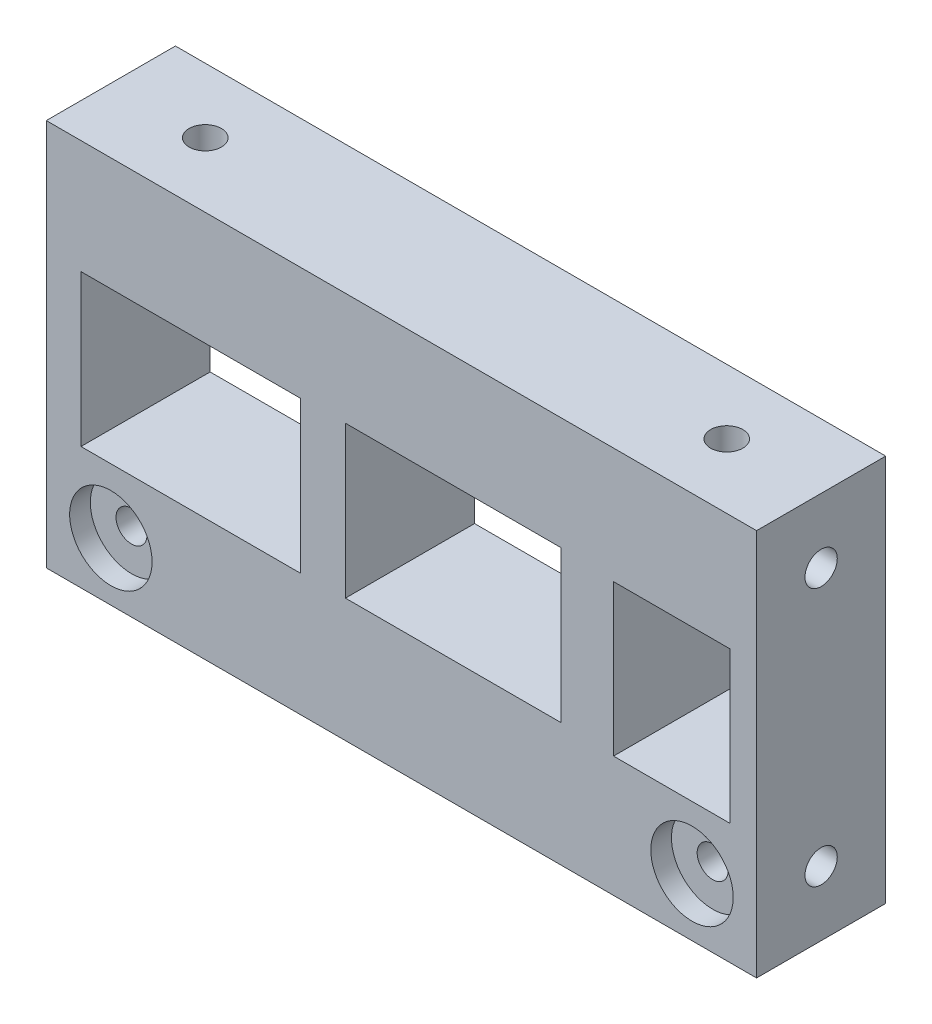
from build123d import *

# Parameters (mm, degrees)
SKETCH1_W                                        = 55
SKETCH1_H                                        = 30
BOSS_EXTRUDE1_DEPTH                              = 10
SKETCH3_W                                        = 16.992180867
SKETCH3_H                                        = 11.731003527
SKETCH3_W_2                                      = 16.707792902
SKETCH3_W_3                                      = 9.029317866
SKETCH3_H_2                                      = 11.700356954
CUT_EXTRUDE1_DEPTH                               = 33.882366095
CBORE_FOR_M2_HEX_HEAD_MACHINE_SCREW2_D           = 2.4
CBORE_FOR_M2_HEX_HEAD_MACHINE_SCREW2_CBORE_D     = 6.38
CBORE_FOR_M2_HEX_HEAD_MACHINE_SCREW2_CBORE_DEPTH = 1.6
M3X0_5_TAPPED_HOLE3_D                            = 2.5
M3X0_5_TAPPED_HOLE3_DEPTH                        = 3
M3X0_5_TAPPED_HOLE3_TIP                          = 0.751075774


with BuildPart() as part:
    # Sketch1 → Boss-Extrude1 (new body)
    with BuildSketch(Plane.XY):
        Rectangle(SKETCH1_W, SKETCH1_H)
    extrude(amount=BOSS_EXTRUDE1_DEPTH)

    # Sketch3 → Cut-Extrude1 (cut, through all)
    with BuildSketch(Plane.XY.offset(10)):
        with Locations((-16.316759452, 0.350583033)):
            Rectangle(SKETCH3_W, SKETCH3_H)
        with Locations((4.016979996, 0.421680025)):
            Rectangle(SKETCH3_W_2, SKETCH3_H)
        with Locations((20.938063871, 0.193065764)):
            Rectangle(SKETCH3_W_3, SKETCH3_H_2)
    extrude(amount=-CUT_EXTRUDE1_DEPTH, mode=Mode.SUBTRACT)

    # CBORE for M2 Hex Head Machine Screw2 (through all)
    with Locations(Plane.XY.offset(10)):
        with Locations((-22.5, -10.5), (22.5, -10.5)):
            CounterBoreHole(CBORE_FOR_M2_HEX_HEAD_MACHINE_SCREW2_D / 2, CBORE_FOR_M2_HEX_HEAD_MACHINE_SCREW2_CBORE_D / 2, CBORE_FOR_M2_HEX_HEAD_MACHINE_SCREW2_CBORE_DEPTH)

    # M3x0.5 Tapped Hole3
    with Locations(Plane(origin=(0, 15, 0), x_dir=(1, 0, 0), z_dir=(0, 1, 0))):
        with Locations((-20.191545465, -5), (20.191545465, -5)):
            Hole(M3X0_5_TAPPED_HOLE3_D / 2, depth=M3X0_5_TAPPED_HOLE3_DEPTH)
            with Locations((0, 0, -(M3X0_5_TAPPED_HOLE3_DEPTH + M3X0_5_TAPPED_HOLE3_TIP / 2))):  # 118° drill point
                Cone(0, M3X0_5_TAPPED_HOLE3_D / 2, M3X0_5_TAPPED_HOLE3_TIP, mode=Mode.SUBTRACT)

    # Sketch12 → M3x0.5 Tapped Hole2 (revolve, cut)
    with BuildSketch(Plane(origin=(-27.5, -10, 5), x_dir=(0, 0, 1), z_dir=(0, 1, 0))):
        Polygon((0, 0), (0, 3.751075774), (1.25, 3), (1.25, 0), align=None)
    m3x0_5_tapped_hole2 = revolve(axis=Axis((-33.85, -10, 5), (1, 0, 0)), mode=Mode.SUBTRACT)

    # Sketch16 → M3x0.5 Tapped Hole1 (revolve, cut)
    with BuildSketch(Plane(origin=(27.5, -10, 5), x_dir=(0, 0, -1), z_dir=(0, 1, 0))):
        Polygon((0, 0), (0, 3.751075774), (1.25, 3), (1.25, 0), align=None)
    m3x0_5_tapped_hole1 = revolve(axis=Axis((33.85, -10, 5), (-1, 0, 0)), mode=Mode.SUBTRACT)

    # Mirror1: M3x0.5 Tapped Hole1 across plane
    add(m3x0_5_tapped_hole1.mirror(Plane.ZX), mode=Mode.SUBTRACT)

    # Mirror2: M3x0.5 Tapped Hole2 across plane
    add(m3x0_5_tapped_hole2.mirror(Plane.ZX), mode=Mode.SUBTRACT)


solid = part.part
